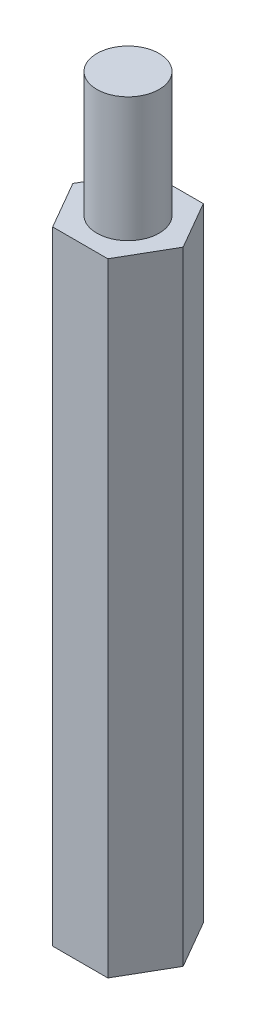
from build123d import *

# Parameters (mm, degrees)
EXTRUDE_1_DEPTH     = 30
SKETCH_2_R          = 1.5
EXTRUDE_2_DEPTH     = 6
SKETCH_3_R          = 1.5
CUT_EXTRUDE_1_DEPTH = 10


with BuildPart() as part:
    # 草图1 → 凸台-拉伸1 (new body)
    with BuildSketch(Plane(origin=(0, 0, 0), x_dir=(1, 0, 0), z_dir=(0, 1, 0))):
        Polygon((2.655811238, 0), (1.327905619, 2.3), (-1.327905619, 2.3), (-2.655811238, 0), (-1.327905619, -2.3), (1.327905619, -2.3), align=None)
    extrude(amount=EXTRUDE_1_DEPTH)

    # 草图2 → 凸台-拉伸2 (add)
    with BuildSketch(Plane(origin=(0, 30, 0), x_dir=(1, 0, 0), z_dir=(0, 1, 0))):
        with Locations(Location((0, 0, 0), (0, 0, 270))):
            Circle(SKETCH_2_R)
    extrude(amount=EXTRUDE_2_DEPTH)

    # 草图3 → 切除-拉伸1 (cut)
    with BuildSketch(Plane.XZ):
        with Locations(Location((0, 0, 0), (0, 0, 90))):
            Circle(SKETCH_3_R)
    extrude(amount=-CUT_EXTRUDE_1_DEPTH, mode=Mode.SUBTRACT)


solid = part.part
